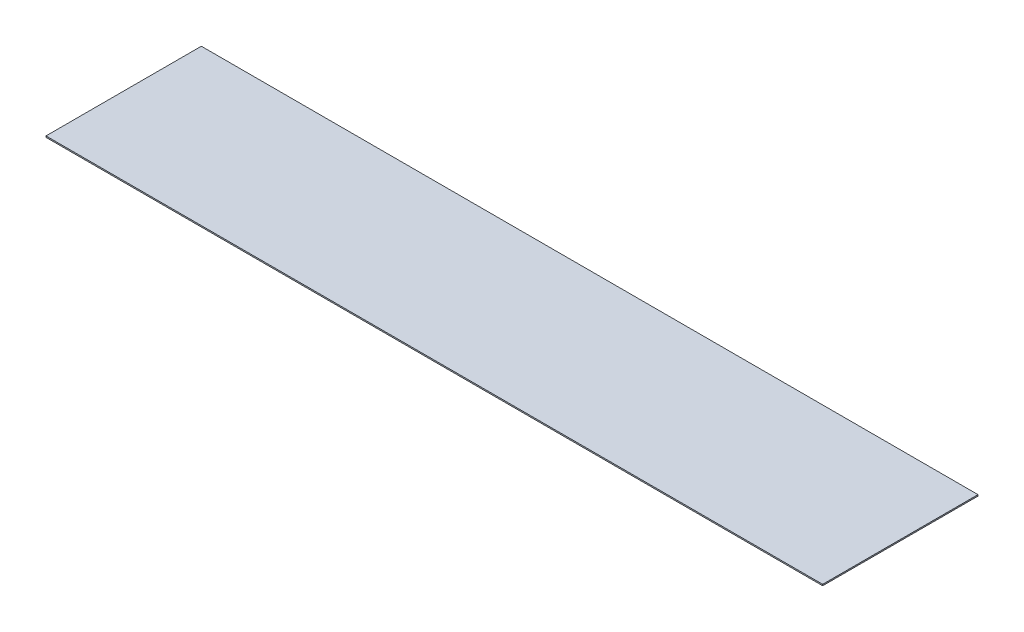
from build123d import *

# Parameters (mm, degrees)
ESQUISSE1_W        = 6000
ESQUISSE1_H        = 1200
BOSS_EXTRU_1_DEPTH = 10


with BuildPart() as part:
    # Esquisse1 → Boss.-Extru.1 (new body)
    with BuildSketch(Plane(origin=(0, 0, 0), x_dir=(1, 0, 0), z_dir=(0, 1, 0))):
        Rectangle(ESQUISSE1_W, ESQUISSE1_H)
    extrude(amount=BOSS_EXTRU_1_DEPTH)


solid = part.part
